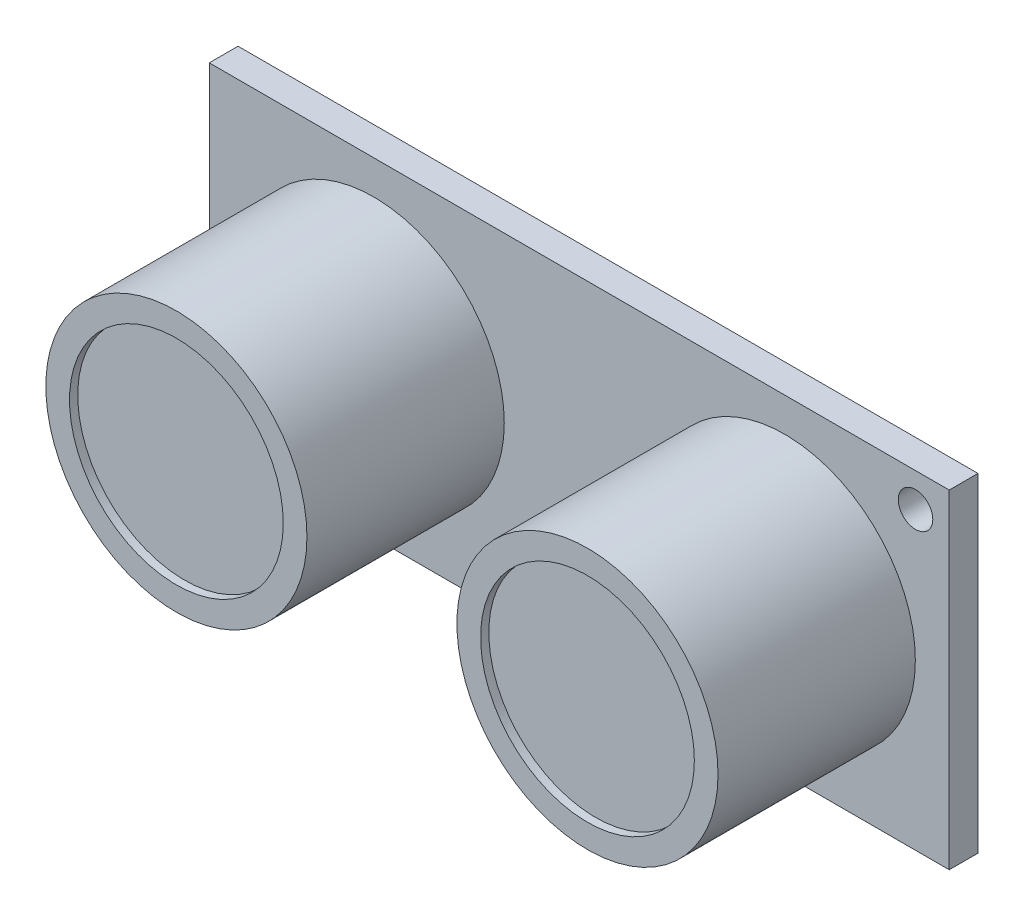
from build123d import *

# Parameters (mm, degrees)
SKETCH1_W              = 45
SKETCH1_H              = 20
SKETCH1_R              = 1.05
BOSS_EXTRUDE1_DEPTH    = 1.75
SKETCH2_R              = 7.94
BOSS_EXTRUDE2_DEPTH    = 12
SKETCH3_R              = 6.5
CUT_EXTRUDE1_DEPTH     = 0.5
SKETCH5_R              = 0.32
FILLET1_R              = 0.32
LPATTERN1_COUNT        = 4
LPATTERN1_PITCH        = 2.54
FILLET1_OF_LPATTERN1_R = 0.32
SKETCH6_W              = 9.860211455
SKETCH6_H              = 2.82135844
BOSS_EXTRUDE3_DEPTH    = 2


with BuildPart() as part:
    # Sketch1 → Boss-Extrude1 (new body)
    with BuildSketch(Plane.XY):
        with Locations((-38.106403473, 15.474006241)):
            Rectangle(SKETCH1_W, SKETCH1_H)
        with Locations((-58.556403473, 7.524006241)):
            Circle(SKETCH1_R, mode=Mode.SUBTRACT)
        with Locations((-17.656403473, 23.424006241)):
            Circle(SKETCH1_R, mode=Mode.SUBTRACT)
    extrude(amount=BOSS_EXTRUDE1_DEPTH)

    # Sketch2 → Boss-Extrude2 (add)
    with BuildSketch(Plane.XY.offset(1.75)):
        with Locations((-50.606403473, 15.474006241)):
            Circle(SKETCH2_R)
        with Locations((-25.606403473, 15.474006241)):
            Circle(SKETCH2_R)
    extrude(amount=BOSS_EXTRUDE2_DEPTH)

    # Sketch3 → Cut-Extrude1 (cut)
    with BuildSketch(Plane.XY.offset(13.75)):
        with Locations((-50.606403473, 15.474006241)):
            Circle(SKETCH3_R)
        with Locations((-25.606403473, 15.474006241)):
            Circle(SKETCH3_R)
    extrude(amount=-CUT_EXTRUDE1_DEPTH, mode=Mode.SUBTRACT)

    # Sweep1: sweep along a path in Sketch4
    with BuildLine(Plane.ZY.offset(41.646403473)) as sweep1_path:
        Line((3.5, 7.374006241), (-3.07, 7.374006241))
        ThreePointArc((-3.07, 7.374006241), (-3.777106781, 7.081113022), (-4.07, 6.374006241))
        Line((-4.07, 6.374006241), (-4.07, 0.944006241))
    # Sketch5 → Sweep1 (sweep)
    with BuildSketch(Plane(origin=(0, 0.944006241, 0), x_dir=(-1, 0, 0), z_dir=(0, -1, 0))):
        with Locations((41.646403473, 4.07)):
            Circle(SKETCH5_R)
    sweep1 = sweep(path=sweep1_path.line)

    # Fillet1
    fillet1_edges = [part.edges().sort_by_distance(p)[0] for p in [
        (-41.326403473, 7.374006241, 3.5),
        (-41.326403473, 0.944006241, -4.07),
    ]]
    fillet(fillet1_edges, radius=FILLET1_R)

    # LPattern1: Sweep1 ×4
    with Locations(*[(i * LPATTERN1_PITCH, 0, 0) for i in range(1, LPATTERN1_COUNT)]):
        add(sweep1)

    # Fillet1 of LPattern1
    fillet1_of_lpattern1_edges = [part.edges().sort_by_distance(p)[0] for p in [
        (-38.786403473, 7.374006241, 3.5),
        (-38.786403473, 0.944006241, -4.07),
        (-36.246403473, 7.374006241, 3.5),
        (-36.246403473, 0.944006241, -4.07),
        (-33.706403473, 7.374006241, 3.5),
        (-33.706403473, 0.944006241, -4.07),
    ]]
    fillet(fillet1_of_lpattern1_edges, radius=FILLET1_OF_LPATTERN1_R)

    # Sketch6 → Boss-Extrude3 (add)
    with BuildSketch(Plane(origin=(0, 0, 0), x_dir=(-1, 0, 0), z_dir=(0, 0, -1))):
        with Locations((37.82340942, 7.284225062)):
            Rectangle(SKETCH6_W, SKETCH6_H)
    extrude(amount=BOSS_EXTRUDE3_DEPTH)


solid = part.part
